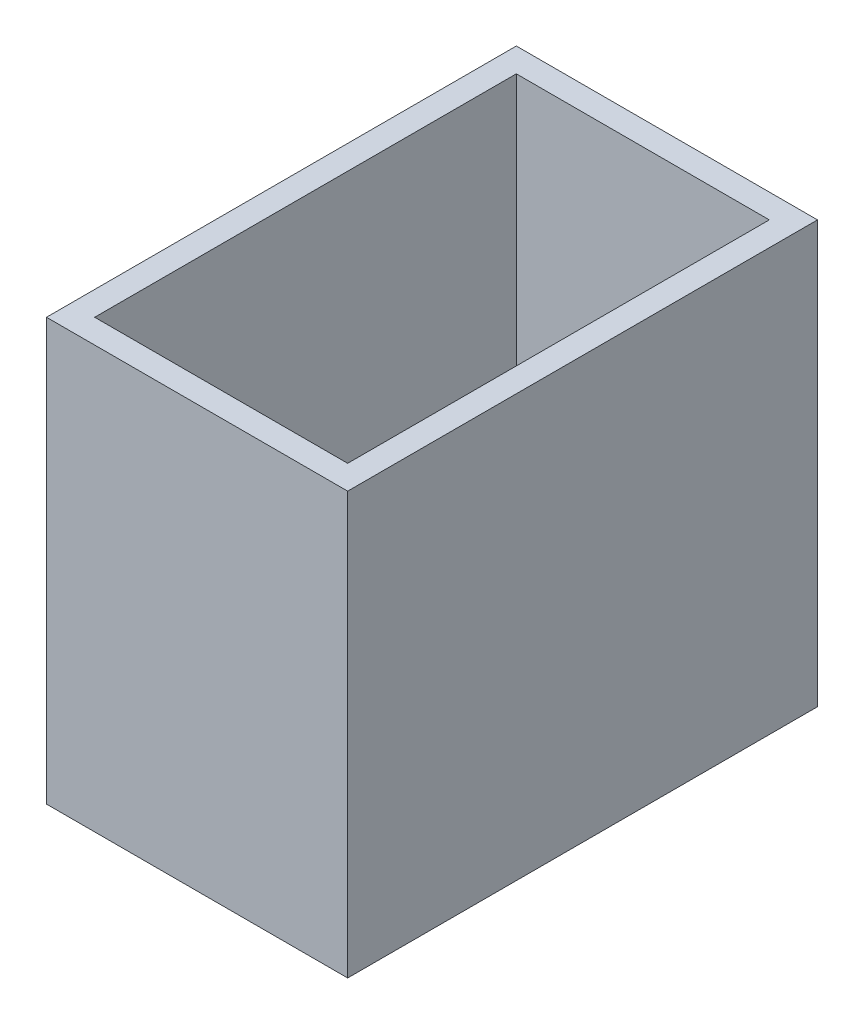
from build123d import *

# Parameters (mm, degrees)
SKETCH1_W               = 25
SKETCH1_H               = 39
SKETCH1_W_2             = 21
SKETCH1_H_2             = 35
BOSS_EXTRUDE1_DEPTH     = 30
SKETCH1_2_W             = 25
SKETCH1_2_H             = 39
BOSS_EXTRUDE2_DEPTH     = 5
CUT_EXTRUDE1_DEPTH      = 38.901187316
CUT_EXTRUDE1_DEPTH_BACK = 38.901187316
SKETCH4_R               = 2.75


with BuildPart() as part:
    # Sketch1 → Boss-Extrude1 (new body)
    with BuildSketch(Plane(origin=(0, 0, 0), x_dir=(1, 0, 0), z_dir=(0, 1, 0))):
        Rectangle(SKETCH1_W, SKETCH1_H)
        Rectangle(SKETCH1_W_2, SKETCH1_H_2, mode=Mode.SUBTRACT)
    extrude(amount=BOSS_EXTRUDE1_DEPTH)

    # Sketch1<2> → Boss-Extrude2 (add)
    with BuildSketch(Plane(origin=(0, 0, 0), x_dir=(1, 0, 0), z_dir=(0, 1, 0))):
        Rectangle(SKETCH1_2_W, SKETCH1_2_H)
    extrude(amount=-BOSS_EXTRUDE2_DEPTH)

    # Sketch4 → Cut-Extrude1 (cut, two sides: drawn at the far end of the back side and taken through both)
    with BuildSketch(Plane(origin=(0, 0, 0), x_dir=(1, 0, 0), z_dir=(0, 1, 0)).offset(-CUT_EXTRUDE1_DEPTH_BACK)):
        Circle(SKETCH4_R)
    extrude(amount=CUT_EXTRUDE1_DEPTH + CUT_EXTRUDE1_DEPTH_BACK, mode=Mode.SUBTRACT)


solid = part.part
